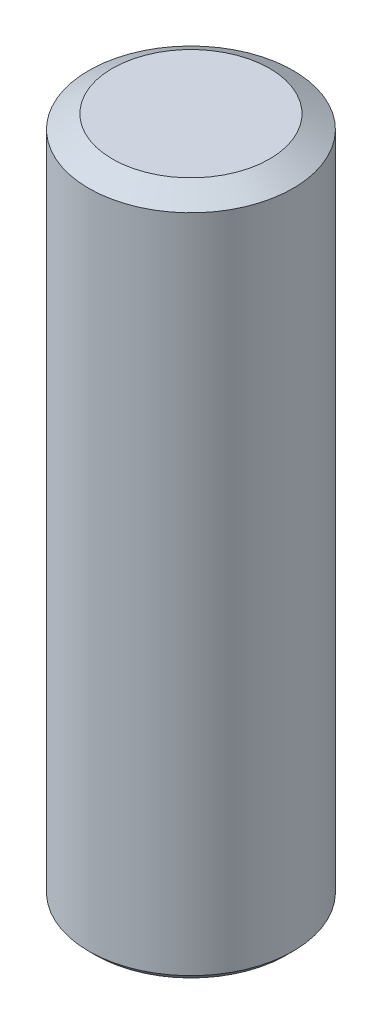
from build123d import *

# Parameters (mm, degrees)
CROQUIS1_R              = 1.5
SALIENTE_EXTRUIR1_DEPTH = 10
CORTAR_EXTRUIR1_DEPTH   = 2
CHAFL_N2_SIZE           = 0.1
CHAFL_N3_SIZE           = 0.2
CHAFL_N3_SIZE2          = 0.346410162


with BuildPart() as part:
    # Croquis1 → Saliente-Extruir1 (new body)
    with BuildSketch(Plane(origin=(0, 0, 0), x_dir=(1, 0, 0), z_dir=(0, 1, 0))):
        with Locations(Location((0, 0, 0), (0, 0, 270))):
            Circle(CROQUIS1_R)
    extrude(amount=SALIENTE_EXTRUIR1_DEPTH)

    # Croquis2 → Cortar-Extruir1 (cut)
    with BuildSketch(Plane.XZ):
        Polygon((0.433012702, 0.75), (-0.433012702, 0.75), (-0.866025404, 0), (-0.433012702, -0.75), (0.433012702, -0.75), (0.866025404, 0), align=None)
    extrude(amount=-CORTAR_EXTRUIR1_DEPTH, mode=Mode.SUBTRACT)

    # Chaflán2
    chafl_n2_edges = [part.edges().sort_by_distance(p)[0] for p in [
        (0, 0, -1.5),
    ]]
    chamfer(chafl_n2_edges, length=CHAFL_N2_SIZE)

    # Chaflán3
    chafl_n3_edges = [part.edges().sort_by_distance(p)[0] for p in [
        (0, 10, -1.5),
    ]]
    chafl_n3_side = [part.faces().sort_by_distance(p)[0] for p in [
        (0, 5.05, -1.5),
    ]]
    chamfer(chafl_n3_edges, length=CHAFL_N3_SIZE, length2=CHAFL_N3_SIZE2, reference=chafl_n3_side[0])


solid = part.part
